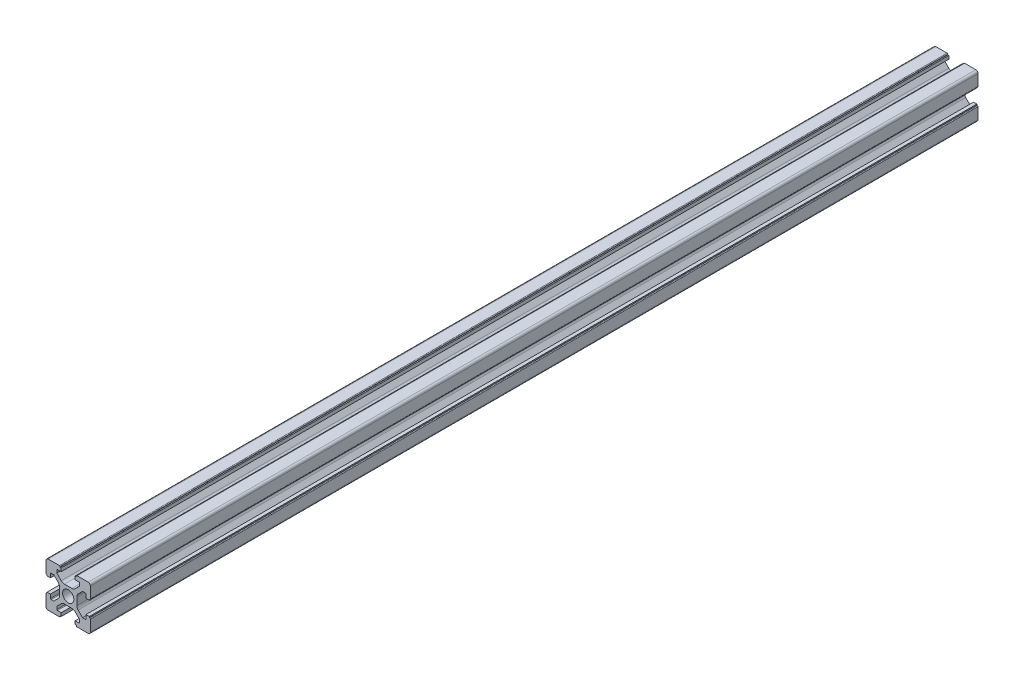
from build123d import *

# Parameters (mm, degrees)
CROQUIS1_RX             = 2.55
CROQUIS1_RY             = 2.55
SALIENTE_EXTRUIR1_DEPTH = 400


with BuildPart() as part:
    # Croquis1 → Saliente-Extruir1 (new body)
    with BuildSketch(Plane.XY):
        with BuildLine():
            Line((-10, -9), (-10, -3.95))
            add(Edge.make_bspline(
                [(-9.7, -3.65), (-10, -3.65), (-10, -3.95)],
                knots=[4.71238898, 4.71238898, 4.71238898, 6.283185307, 6.283185307, 6.283185307], degree=2, weights=[1, 0.707106781, 1]))
            Line((-9.7, -3.65), (-9.5, -3.65))
            Line((-9.5, -3.65), (-9.5, -3.15))
            Line((-9.5, -3.15), (-8, -3.15))
            Line((-8, -3.15), (-8, -4.85))
            add(Edge.make_bspline(
                [(-8, -4.85), (-8, -5.15), (-7.7, -5.15)],
                knots=[3.141592654, 3.141592654, 3.141592654, 4.71238898, 4.71238898, 4.71238898], degree=2, weights=[1, 0.707106781, 1]))
            Line((-7.7, -5.15), (-6.5, -5.15))
            Line((-6.5, -5.15), (-4.485786438, -3.135786438))
            add(Edge.make_bspline(
                [(-4.485786438, -3.135786438), (-3.9, -2.55), (-3.9, -1.721572875)],
                knots=[3.926990817, 3.926990817, 3.926990817, 4.71238898, 4.71238898, 4.71238898], degree=2, weights=[1, 0.923879533, 1]))
            Line((-3.9, -1.721572875), (-3.9, 1.721572875))
            add(Edge.make_bspline(
                [(-3.9, 1.721572875), (-3.9, 2.55), (-4.485786438, 3.135786438)],
                knots=[3.141592654, 3.141592654, 3.141592654, 3.926990817, 3.926990817, 3.926990817], degree=2, weights=[1, 0.923879533, 1]))
            Line((-4.485786438, 3.135786438), (-6.5, 5.15))
            Line((-6.5, 5.15), (-7.7, 5.15))
            add(Edge.make_bspline(
                [(-7.7, 5.15), (-8, 5.15), (-8, 4.85)],
                knots=[1.570796327, 1.570796327, 1.570796327, 3.141592654, 3.141592654, 3.141592654], degree=2, weights=[1, 0.707106781, 1]))
            Line((-8, 4.85), (-8, 3.15))
            Line((-8, 3.15), (-9.5, 3.15))
            Line((-9.5, 3.15), (-9.5, 3.65))
            Line((-9.5, 3.65), (-9.7, 3.65))
            add(Edge.make_bspline(
                [(-10, 3.95), (-10, 3.65), (-9.7, 3.65)],
                knots=[3.141592654, 3.141592654, 3.141592654, 4.71238898, 4.71238898, 4.71238898], degree=2, weights=[1, 0.707106781, 1]))
            Line((-10, 3.95), (-10, 9))
            add(Edge.make_bspline(
                [(-9, 10), (-10, 10), (-10, 9)],
                knots=[4.71238898, 4.71238898, 4.71238898, 6.283185307, 6.283185307, 6.283185307], degree=2, weights=[1, 0.707106781, 1]))
            Line((-9, 10), (-3.95, 10))
            add(Edge.make_bspline(
                [(-3.65, 9.7), (-3.65, 10), (-3.95, 10)],
                knots=[0, 0, 0, 1.570796327, 1.570796327, 1.570796327], degree=2, weights=[1, 0.707106781, 1]))
            Line((-3.65, 9.7), (-3.65, 9.5))
            Line((-3.65, 9.5), (-3.15, 9.5))
            Line((-3.15, 9.5), (-3.15, 8))
            Line((-3.15, 8), (-4.85, 8))
            add(Edge.make_bspline(
                [(-4.85, 8), (-5.15, 8), (-5.15, 7.7)],
                knots=[1.570796327, 1.570796327, 1.570796327, 3.141592654, 3.141592654, 3.141592654], degree=2, weights=[1, 0.707106781, 1]))
            Line((-5.15, 7.7), (-5.15, 6.5))
            Line((-5.15, 6.5), (-3.135786438, 4.485786438))
            add(Edge.make_bspline(
                [(-3.135786438, 4.485786438), (-2.55, 3.9), (-1.721572875, 3.9)],
                knots=[0.785398163, 0.785398163, 0.785398163, 1.570796327, 1.570796327, 1.570796327], degree=2, weights=[1, 0.923879533, 1]))
            Line((-1.721572875, 3.9), (1.721572875, 3.9))
            add(Edge.make_bspline(
                [(1.721572875, 3.9), (2.55, 3.9), (3.135786438, 4.485786438)],
                knots=[1.570796327, 1.570796327, 1.570796327, 2.35619449, 2.35619449, 2.35619449], degree=2, weights=[1, 0.923879533, 1]))
            Line((3.135786438, 4.485786438), (5.15, 6.5))
            Line((5.15, 6.5), (5.15, 7.7))
            add(Edge.make_bspline(
                [(5.15, 7.7), (5.15, 8), (4.85, 8)],
                knots=[4.71238898, 4.71238898, 4.71238898, 6.283185307, 6.283185307, 6.283185307], degree=2, weights=[1, 0.707106781, 1]))
            Line((4.85, 8), (3.15, 8))
            Line((3.15, 8), (3.15, 9.5))
            Line((3.15, 9.5), (3.65, 9.5))
            Line((3.65, 9.5), (3.65, 9.7))
            add(Edge.make_bspline(
                [(3.95, 10), (3.65, 10), (3.65, 9.7)],
                knots=[3.141592654, 3.141592654, 3.141592654, 4.71238898, 4.71238898, 4.71238898], degree=2, weights=[1, 0.707106781, 1]))
            Line((3.95, 10), (9, 10))
            add(Edge.make_bspline(
                [(10, 9), (10, 10), (9, 10)],
                knots=[0, 0, 0, 1.570796327, 1.570796327, 1.570796327], degree=2, weights=[1, 0.707106781, 1]))
            Line((10, 9), (10, 3.95))
            add(Edge.make_bspline(
                [(9.7, 3.65), (10, 3.65), (10, 3.95)],
                knots=[4.71238898, 4.71238898, 4.71238898, 6.283185307, 6.283185307, 6.283185307], degree=2, weights=[1, 0.707106781, 1]))
            Line((9.7, 3.65), (9.5, 3.65))
            Line((9.5, 3.65), (9.5, 3.15))
            Line((9.5, 3.15), (8, 3.15))
            Line((8, 3.15), (8, 4.85))
            add(Edge.make_bspline(
                [(8, 4.85), (8, 5.15), (7.7, 5.15)],
                knots=[0, 0, 0, 1.570796327, 1.570796327, 1.570796327], degree=2, weights=[1, 0.707106781, 1]))
            Line((7.7, 5.15), (6.5, 5.15))
            Line((6.5, 5.15), (4.485786438, 3.135786438))
            add(Edge.make_bspline(
                [(4.485786438, 3.135786438), (3.9, 2.55), (3.9, 1.721572875)],
                knots=[2.35619449, 2.35619449, 2.35619449, 3.141592654, 3.141592654, 3.141592654], degree=2, weights=[1, 0.923879533, 1]))
            Line((3.9, 1.721572875), (3.9, -1.721572875))
            add(Edge.make_bspline(
                [(3.9, -1.721572875), (3.9, -2.55), (4.485786438, -3.135786438)],
                knots=[3.141592654, 3.141592654, 3.141592654, 3.926990817, 3.926990817, 3.926990817], degree=2, weights=[1, 0.923879533, 1]))
            Line((4.485786438, -3.135786438), (6.5, -5.15))
            Line((6.5, -5.15), (7.7, -5.15))
            add(Edge.make_bspline(
                [(7.7, -5.15), (8, -5.15), (8, -4.85)],
                knots=[4.71238898, 4.71238898, 4.71238898, 6.283185307, 6.283185307, 6.283185307], degree=2, weights=[1, 0.707106781, 1]))
            Line((8, -4.85), (8, -3.15))
            Line((8, -3.15), (9.5, -3.15))
            Line((9.5, -3.15), (9.5, -3.65))
            Line((9.5, -3.65), (9.7, -3.65))
            add(Edge.make_bspline(
                [(10, -3.95), (10, -3.65), (9.7, -3.65)],
                knots=[0, 0, 0, 1.570796327, 1.570796327, 1.570796327], degree=2, weights=[1, 0.707106781, 1]))
            Line((10, -3.95), (10, -9))
            add(Edge.make_bspline(
                [(9, -10), (10, -10), (10, -9)],
                knots=[4.71238898, 4.71238898, 4.71238898, 6.283185307, 6.283185307, 6.283185307], degree=2, weights=[1, 0.707106781, 1]))
            Line((9, -10), (3.95, -10))
            add(Edge.make_bspline(
                [(3.65, -9.7), (3.65, -10), (3.95, -10)],
                knots=[1.570796327, 1.570796327, 1.570796327, 3.141592654, 3.141592654, 3.141592654], degree=2, weights=[1, 0.707106781, 1]))
            Line((3.65, -9.7), (3.65, -9.5))
            Line((3.65, -9.5), (3.15, -9.5))
            Line((3.15, -9.5), (3.15, -8))
            Line((3.15, -8), (4.85, -8))
            add(Edge.make_bspline(
                [(4.85, -8), (5.15, -8), (5.15, -7.7)],
                knots=[3.141592654, 3.141592654, 3.141592654, 4.71238898, 4.71238898, 4.71238898], degree=2, weights=[1, 0.707106781, 1]))
            Line((5.15, -7.7), (5.15, -6.5))
            Line((5.15, -6.5), (3.135786438, -4.485786438))
            add(Edge.make_bspline(
                [(3.135786438, -4.485786438), (2.55, -3.9), (1.721572875, -3.9)],
                knots=[5.497787144, 5.497787144, 5.497787144, 6.283185307, 6.283185307, 6.283185307], degree=2, weights=[1, 0.923879533, 1]))
            Line((1.721572875, -3.9), (-1.721572875, -3.9))
            add(Edge.make_bspline(
                [(-1.721572875, -3.9), (-2.55, -3.9), (-3.135786438, -4.485786438)],
                knots=[0, 0, 0, 0.785398163, 0.785398163, 0.785398163], degree=2, weights=[1, 0.923879533, 1]))
            Line((-3.135786438, -4.485786438), (-5.15, -6.5))
            Line((-5.15, -6.5), (-5.15, -7.7))
            add(Edge.make_bspline(
                [(-5.15, -7.7), (-5.15, -8), (-4.85, -8)],
                knots=[3.141592654, 3.141592654, 3.141592654, 4.71238898, 4.71238898, 4.71238898], degree=2, weights=[1, 0.707106781, 1]))
            Line((-4.85, -8), (-3.15, -8))
            Line((-3.15, -8), (-3.15, -9.5))
            Line((-3.15, -9.5), (-3.65, -9.5))
            Line((-3.65, -9.5), (-3.65, -9.7))
            add(Edge.make_bspline(
                [(-3.95, -10), (-3.65, -10), (-3.65, -9.7)],
                knots=[4.71238898, 4.71238898, 4.71238898, 6.283185307, 6.283185307, 6.283185307], degree=2, weights=[1, 0.707106781, 1]))
            Line((-3.95, -10), (-9, -10))
            add(Edge.make_bspline(
                [(-10, -9), (-10, -10), (-9, -10)],
                knots=[0, 0, 0, 1.570796327, 1.570796327, 1.570796327], degree=2, weights=[1, 0.707106781, 1]))
        make_face()
        with Locations((0, 0)):
            Ellipse(CROQUIS1_RX, CROQUIS1_RY, mode=Mode.SUBTRACT)
    extrude(amount=SALIENTE_EXTRUIR1_DEPTH)


solid = part.part
